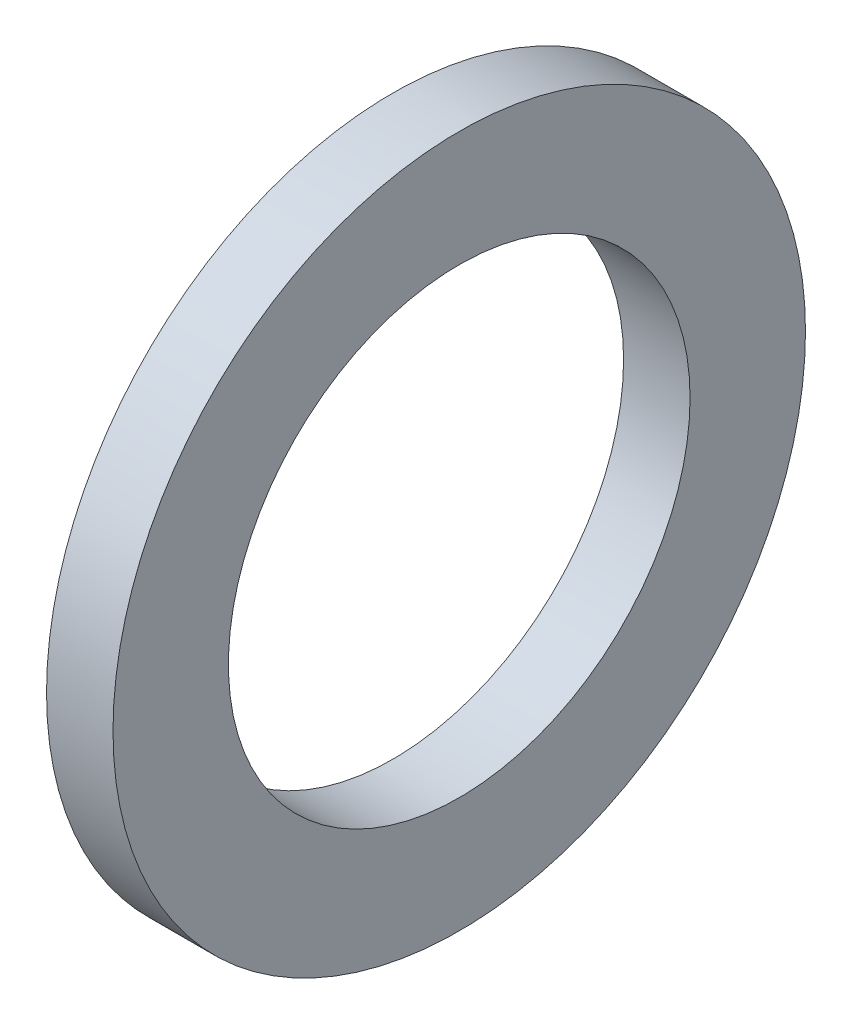
from build123d import *

# Parameters (mm, degrees)
SKETCH1_R           = 4.7625
SKETCH1_R_2         = 3.175
BOSS_EXTRUDE1_DEPTH = 0.9144


with BuildPart() as part:
    # Sketch1 → Boss-Extrude1 (new body)
    with BuildSketch(Plane(origin=(0, 0, 0), x_dir=(0, 0, -1), z_dir=(1, 0, 0))):
        Circle(SKETCH1_R)
        Circle(SKETCH1_R_2, mode=Mode.SUBTRACT)
    extrude(amount=BOSS_EXTRUDE1_DEPTH)


solid = part.part
